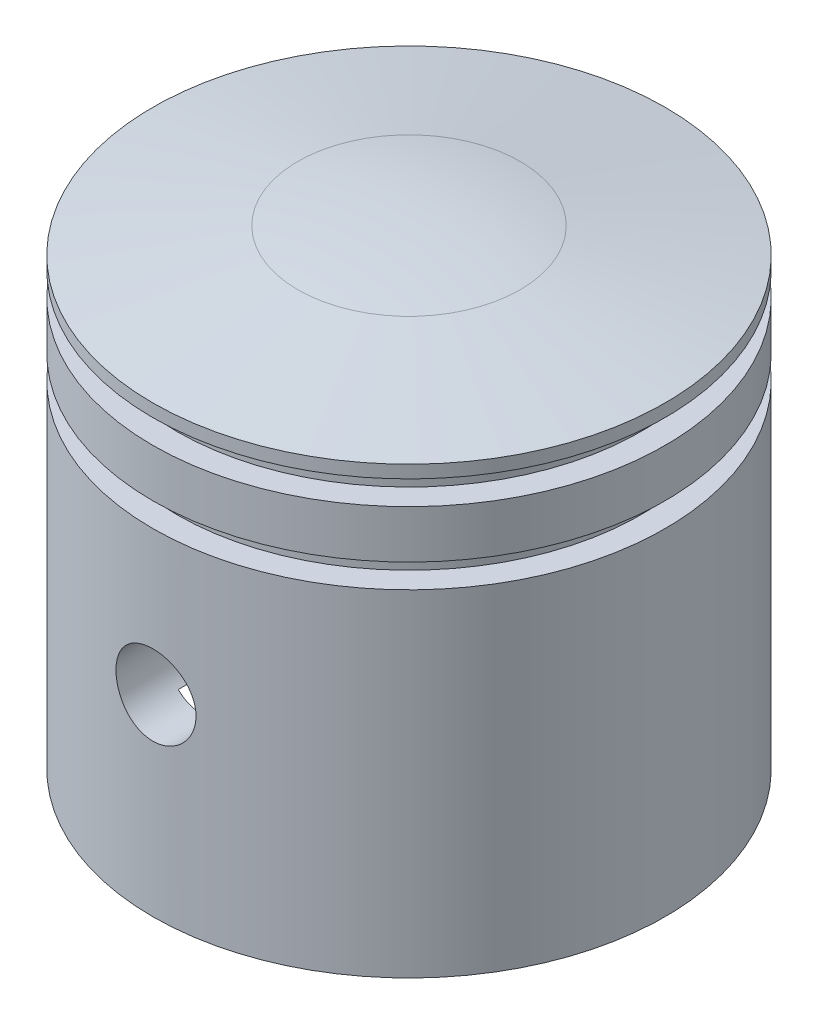
from build123d import *

# Parameters (mm, degrees)
SKETCH2_W               = 1.5
SKETCH2_H               = 1.5
CUT_EXTRUDE1_DEPTH      = 38.576588456
CUT_EXTRUDE1_DEPTH_BACK = 38.576588456
SKETCH3_R               = 2.5
SKETCH4_R               = 10
CUT_EXTRUDE2_DEPTH      = 24
SKETCH5_R               = 13
CUT_EXTRUDE3_DEPTH      = 10


with BuildPart() as part:
    # Sketch1 → Revolve1 (revolve)
    with BuildSketch(Plane.XY, mode=Mode.PRIVATE) as revolve1_sk:
        with BuildLine():
            Line((0, 0), (16, 0))
            Line((16, 0), (16, 27.795832784))
            Line((16, 27.795832784), (6.945927107, 29.39231012))
            ThreePointArc((6.945927107, 29.39231012), (3.48622971, 29.847787924), (0, 30))
            Line((0, 30), (0, 0))
        make_face()
    revolve(revolve1_sk.sketch.rotate(Axis((0, 30, 0), (0, -1, 0)), 90), axis=Axis((0, 30, 0), (0, -1, 0)))

    # Sketch2 → Cut-Revolve1 (revolve, cut)
    with BuildSketch(Plane.XY, mode=Mode.PRIVATE) as cut_revolve1_sk:
        with Locations((15.25, 26.25)):
            Rectangle(SKETCH2_W, SKETCH2_H)
        with Locations((15.25, 21.75)):
            Rectangle(SKETCH2_W, SKETCH2_H)
    revolve(cut_revolve1_sk.sketch.rotate(Axis((0, 34.005478298, 0), (0, -1, 0)), 90), axis=Axis((0, 34.005478298, 0), (0, -1, 0)), mode=Mode.SUBTRACT)

    # Sketch3 → Cut-Extrude1 (cut, two sides: drawn at the far end of the back side and taken through both)
    with BuildSketch(Plane.XY.offset(-CUT_EXTRUDE1_DEPTH_BACK)):
        with Locations(Location((0, 12, 0), (0, 0, 90))):
            Circle(SKETCH3_R)
    extrude(amount=CUT_EXTRUDE1_DEPTH + CUT_EXTRUDE1_DEPTH_BACK, mode=Mode.SUBTRACT)

    # Sketch4 → Cut-Extrude2 (cut)
    with BuildSketch(Plane.XZ):
        with Locations(Location((0, 0, 0), (0, 0, 270))):
            Circle(SKETCH4_R)
    extrude(amount=-CUT_EXTRUDE2_DEPTH, mode=Mode.SUBTRACT)

    # Sketch5 → Cut-Extrude3 (cut)
    with BuildSketch(Plane.XZ):
        with Locations(Location((0, 0, 0), (0, 0, 270))):
            Circle(SKETCH5_R)
    extrude(amount=-CUT_EXTRUDE3_DEPTH, mode=Mode.SUBTRACT)


solid = part.part
